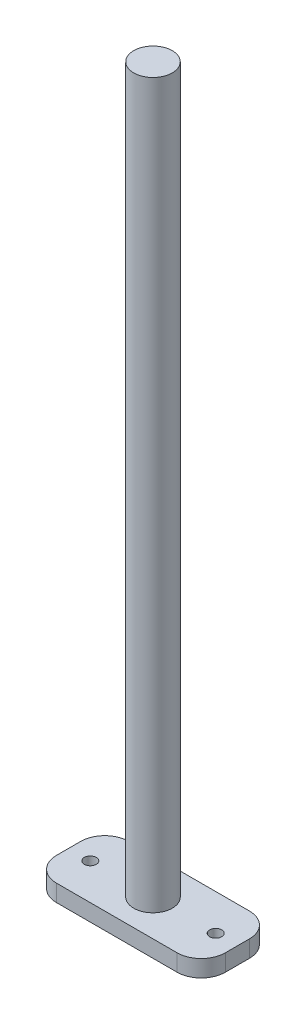
from build123d import *

# Parameters (mm, degrees)
CROQUIS1_R              = 4
CROQUIS1_R_2            = 1.25
SALIENTE_EXTRUIR1_DEPTH = 3.5
CROQUIS2_R              = 4
SALIENTE_EXTRUIR2_DEPTH = 150


with BuildPart() as part:
    # Croquis1 → Saliente-Extruir1 (new body)
    # profile 1 of 2: a face of its own
    with BuildSketch(Plane(origin=(0, 0, 0), x_dir=(1, 0, 0), z_dir=(0, 1, 0))):
        with BuildLine():
            Line((17.5, 2.5), (17.5, -2.5))
            ThreePointArc((17.5, -2.5), (16.035533906, -6.035533906), (12.5, -7.5))
            Line((12.5, -7.5), (-12.5, -7.5))
            ThreePointArc((-12.5, -7.5), (-16.035533906, -6.035533906), (-17.5, -2.5))
            Line((-17.5, -2.5), (-17.5, 2.5))
            ThreePointArc((-17.5, 2.5), (-16.035533906, 6.035533906), (-12.5, 7.5))
            Line((-12.5, 7.5), (12.5, 7.5))
            ThreePointArc((12.5, 7.5), (16.035533906, 6.035533906), (17.5, 2.5))
        make_face()
        Circle(CROQUIS1_R, mode=Mode.SUBTRACT)
        with Locations(Location((-13, 0, 0), (0, 0, 270))):
            Circle(CROQUIS1_R_2, mode=Mode.SUBTRACT)
        with Locations(Location((13, 0, 0), (0, 0, 270))):
            Circle(CROQUIS1_R_2, mode=Mode.SUBTRACT)
    # profile 2 of 2: a face of its own
    with BuildSketch(Plane(origin=(0, 0, 0), x_dir=(1, 0, 0), z_dir=(0, 1, 0))):
        Circle(CROQUIS1_R)
    extrude(amount=SALIENTE_EXTRUIR1_DEPTH)

    # Croquis2 → Saliente-Extruir2 (add)
    with BuildSketch(Plane(origin=(0, 3.5, 0), x_dir=(1, 0, 0), z_dir=(0, 1, 0))):
        with Locations(Location((0, 0, 0), (0, 0, 270))):
            Circle(CROQUIS2_R)
    extrude(amount=SALIENTE_EXTRUIR2_DEPTH)


solid = part.part
